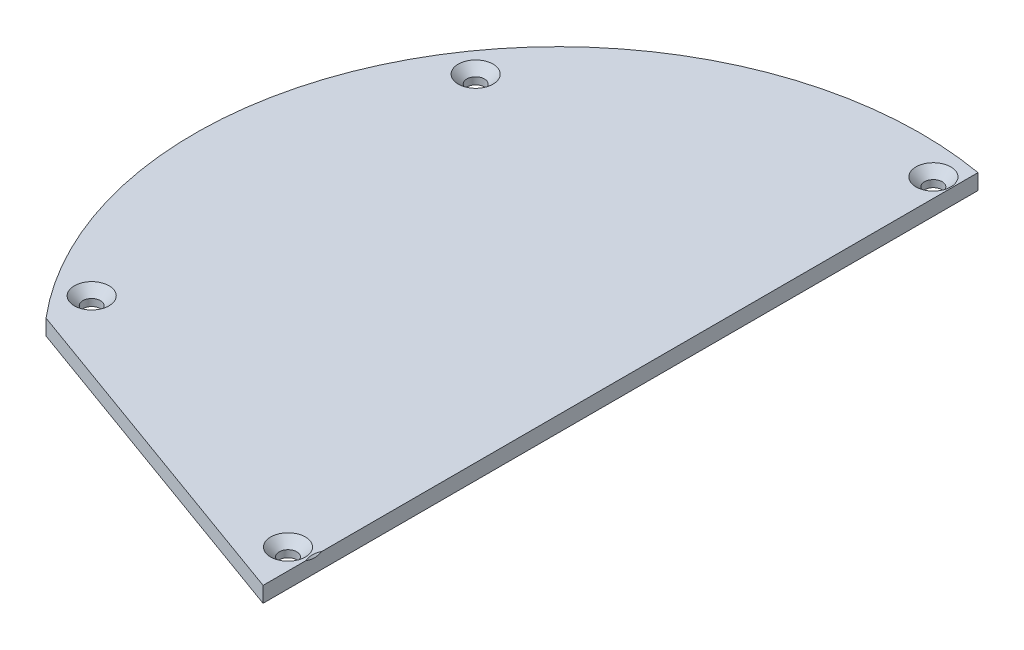
from build123d import *

# Parameters (mm, degrees)
BOSS_EXTRUDE1_DEPTH                            = 3
CSK_FOR_M3_FLAT_HEAD_MACHINE_SCREW1_AT_2_COUNT = 2
CSK_FOR_M3_FLAT_HEAD_MACHINE_SCREW1_AT_2_PITCH = 71.314927951
CSK_FOR_M3_FLAT_HEAD_MACHINE_SCREW1_AT_3_COUNT = 2
CSK_FOR_M3_FLAT_HEAD_MACHINE_SCREW1_AT_3_PITCH = 7.071067812
CSK_FOR_M3_FLAT_HEAD_MACHINE_SCREW1_AT_4_COUNT = 2
CSK_FOR_M3_FLAT_HEAD_MACHINE_SCREW1_AT_4_PITCH = 123.124200131
CSK_FOR_M3_FLAT_HEAD_MACHINE_SCREW1_AT_5_COUNT = 2
CSK_FOR_M3_FLAT_HEAD_MACHINE_SCREW1_AT_5_PITCH = 117.544882759


with BuildPart() as part:
    # Sketch1 → Boss-Extrude1 (new body)
    with BuildSketch(Plane(origin=(0, 0, 0), x_dir=(1, 0, 0), z_dir=(0, 1, 0))):
        with BuildLine():
            Line((12, 68.963758598), (12, -68.802405773))
            Line((12, -68.802405773), (-53.528576558, -45.107554707))
            ThreePointArc((-53.528576558, -45.107554707), (-60.697790714, 34.868011163), (12, 68.963758598))
        make_face()
    extrude(amount=BOSS_EXTRUDE1_DEPTH)

    # Sketch4 → CSK for M3 Flat Head Machine Screw1 (revolve, cut)
    with BuildSketch(Plane(origin=(15, 3, 59), x_dir=(0, 0, 1), z_dir=(1, 0, 0))):
        Polygon((0, 0), (0, 3), (1.7, 3), (1.7, 1.65), (3.35, 0), align=None)
    csk_for_m3_flat_head_machine_screw1 = revolve(axis=Axis((15, 9.35, 59), (0, -1, 0)), mode=Mode.SUBTRACT)

    # CSK for M3 Flat Head Machine Screw1 at 2: CSK for M3 Flat Head Machine Screw1 ×2
    with Locations(*[Vector(-0.9512076756694684, 0, -0.30855138591081943) * (i * CSK_FOR_M3_FLAT_HEAD_MACHINE_SCREW1_AT_2_PITCH) for i in range(1, CSK_FOR_M3_FLAT_HEAD_MACHINE_SCREW1_AT_2_COUNT)]):
        add(csk_for_m3_flat_head_machine_screw1, mode=Mode.SUBTRACT)

    # CSK for M3 Flat Head Machine Screw1 at 3: CSK for M3 Flat Head Machine Screw1 ×2
    with Locations(*[Vector(-0.9899494936611665, 0, 0.14142135623730978) * (i * CSK_FOR_M3_FLAT_HEAD_MACHINE_SCREW1_AT_3_PITCH) for i in range(1, CSK_FOR_M3_FLAT_HEAD_MACHINE_SCREW1_AT_3_COUNT)]):
        add(csk_for_m3_flat_head_machine_screw1, mode=Mode.SUBTRACT)

    # CSK for M3 Flat Head Machine Screw1 at 4: CSK for M3 Flat Head Machine Screw1 ×2
    with Locations(*[Vector(-0.053450585626457235, 0, -0.9985704957068323) * (i * CSK_FOR_M3_FLAT_HEAD_MACHINE_SCREW1_AT_4_PITCH) for i in range(1, CSK_FOR_M3_FLAT_HEAD_MACHINE_SCREW1_AT_4_COUNT)]):
        add(csk_for_m3_flat_head_machine_screw1, mode=Mode.SUBTRACT)

    # CSK for M3 Flat Head Machine Screw1 at 5: CSK for M3 Flat Head Machine Screw1 ×2
    with Locations(*[Vector(-0.5771013187861944, 0, -0.8166725585295709) * (i * CSK_FOR_M3_FLAT_HEAD_MACHINE_SCREW1_AT_5_PITCH) for i in range(1, CSK_FOR_M3_FLAT_HEAD_MACHINE_SCREW1_AT_5_COUNT)]):
        add(csk_for_m3_flat_head_machine_screw1, mode=Mode.SUBTRACT)


solid = part.part
